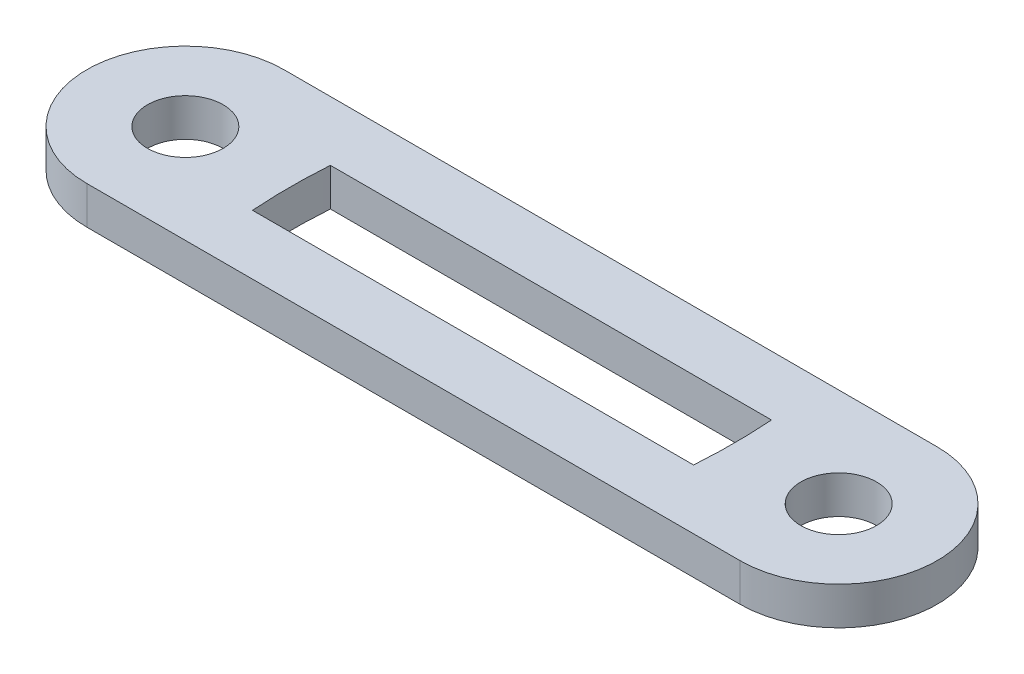
from build123d import *

# Parameters (mm, degrees)
SKETCH1_R           = 1.5875
BOSS_EXTRUDE2_DEPTH = 0.79375


with BuildPart() as part:
    # Sketch1 → Boss-Extrude2 (new, symmetric)
    with BuildSketch(Plane(origin=(0, 0, 0), x_dir=(1, 0, 0), z_dir=(0, 1, 0))):
        with BuildLine():
            Line((13.7, 4.133736316), (-13.7, 4.133736316))
            ThreePointArc((-13.7, 4.133736316), (-17.833736316, 0), (-13.7, -4.133736316))
            Line((-13.7, -4.133736316), (13.7, -4.133736316))
            ThreePointArc((13.7, -4.133736316), (17.833736316, 0), (13.7, 4.133736316))
        make_face()
        with Locations(Location((13.7, 0, 0), (0, 0, 270))):
            Circle(SKETCH1_R, mode=Mode.SUBTRACT)
        with Locations(Location((-13.7, 0, 0), (0, 0, 270))):
            Circle(SKETCH1_R, mode=Mode.SUBTRACT)
        with BuildLine():
            Line((9.249344571, -1.633736316), (-9.249344571, -1.633736316))
            ThreePointArc((-9.249344571, -1.633736316), (-9.307422945, 0), (-9.249344571, 1.633736316))
            Line((-9.249344571, 1.633736316), (9.249344571, 1.633736316))
            ThreePointArc((9.249344571, 1.633736316), (9.307422945, 0), (9.249344571, -1.633736316))
        make_face(mode=Mode.SUBTRACT)
    extrude(amount=BOSS_EXTRUDE2_DEPTH, both=True)


solid = part.part
